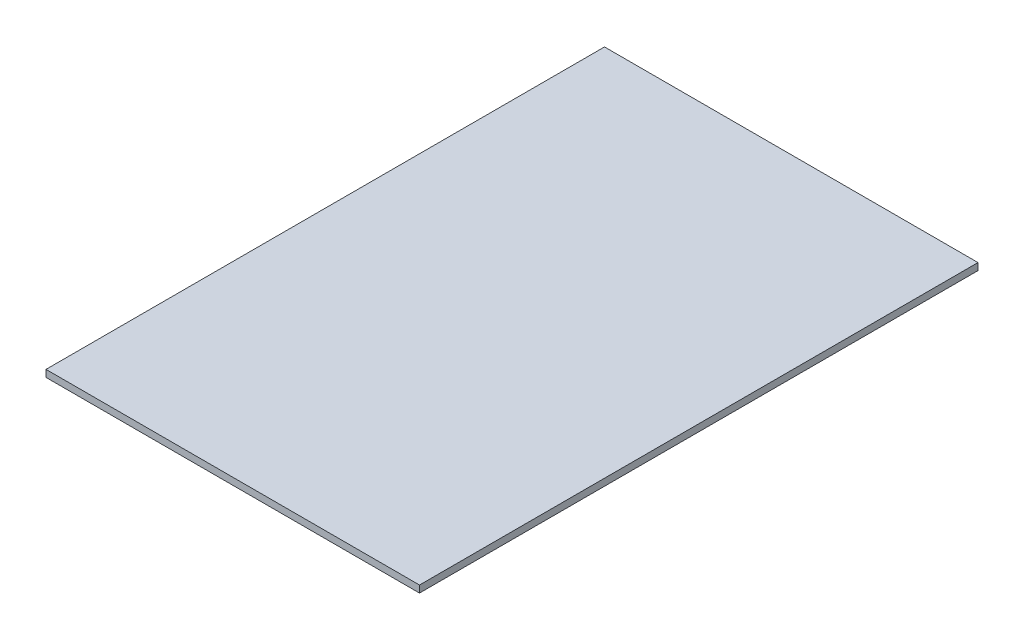
from build123d import *

# Parameters (mm, degrees)
SKETCH2_W           = 107
SKETCH2_H           = 160
BOSS_EXTRUDE1_DEPTH = 2


with BuildPart() as part:
    # Sketch2 → Boss-Extrude1 (new body)
    with BuildSketch(Plane(origin=(0, 0, 0), x_dir=(1, 0, 0), z_dir=(0, 1, 0))):
        with Locations((-53.5, -80)):
            Rectangle(SKETCH2_W, SKETCH2_H)
    extrude(amount=BOSS_EXTRUDE1_DEPTH)


solid = part.part
